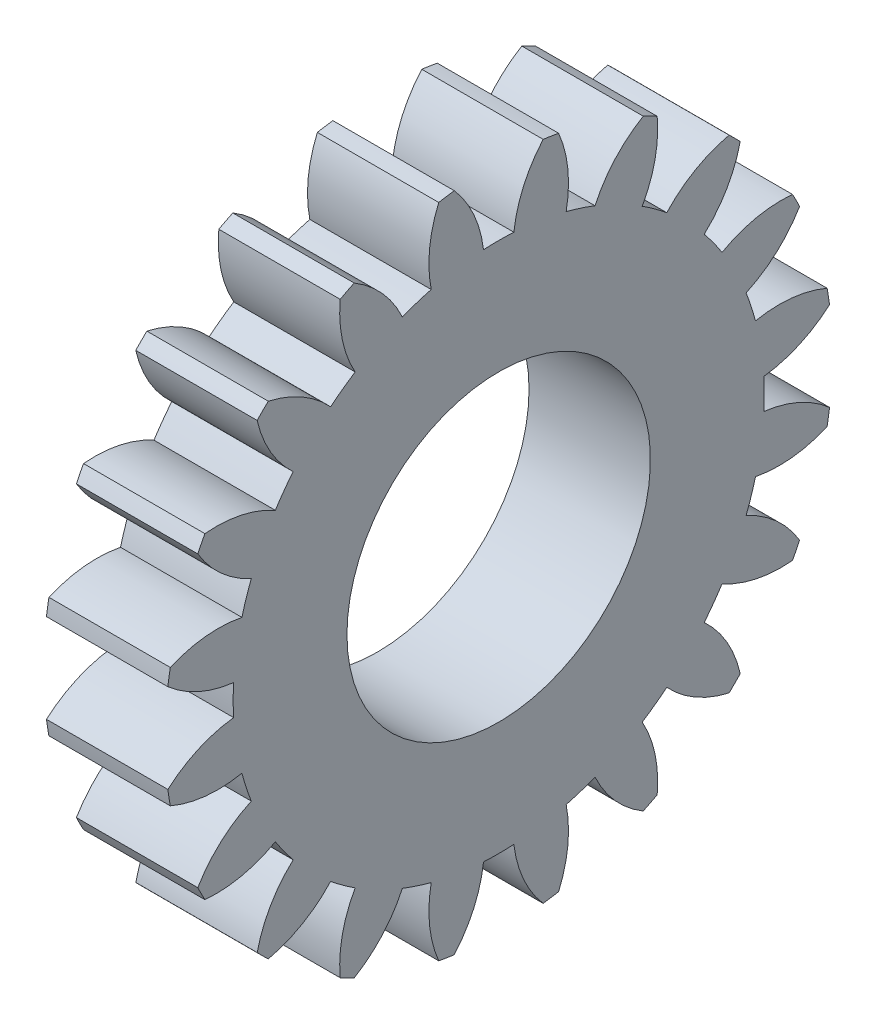
from build123d import *

# Parameters (mm, degrees)
BASPROSKE_W     = 4
BASPROSKE_H     = 11
TOOTHCUT_DEPTH  = 17.062378404
TEETHCUTS_COUNT = 20
TEETHCUTS_ANGLE = 342
BORSKE_R        = 5
BORE_DEPTH      = 50.0000508


with BuildPart() as part:
    # BasProSke → Base-Revolve (revolve)
    with BuildSketch(Plane(origin=(0, 0, 0), x_dir=(1, 0, 0), z_dir=(0, 1, 0)), mode=Mode.PRIVATE) as base_revolve_sk:
        with Locations((2, 5.5)):
            Rectangle(BASPROSKE_W, BASPROSKE_H)
    revolve(base_revolve_sk.sketch.rotate(Axis((-10, 0, 0), (1, 0, 0)), 180), axis=Axis((-10, 0, 0), (1, 0, 0)))

    # TooCutSke → ToothCut (cut, through all)
    with BuildSketch(Plane(origin=(0, 0, 0), x_dir=(0, 0, -1), z_dir=(1, 0, 0))):
        with BuildLine():
            ThreePointArc((0.499924007, 8.734705318), (0, 8.749), (-0.499924007, 8.734705318))
            ThreePointArc((-0.499924007, 8.734705318), (-0.824302243, 9.905497836), (-1.485192705, 10.924909509))
            ThreePointArc((-1.485192705, 10.924909509), (0, 11.0254), (1.485192705, 10.924909509))
            ThreePointArc((1.485192705, 10.924909509), (0.824302243, 9.905497836), (0.499924007, 8.734705318))
        make_face()
    toothcut = extrude(amount=TOOTHCUT_DEPTH, mode=Mode.SUBTRACT)

    # TeethCuts: ToothCut ×20 about axis
    teethcuts_axis = Axis((-10, 0, 0), (1, 0, 0))
    for i in range(1, TEETHCUTS_COUNT):
        add(toothcut.rotate(teethcuts_axis, i * TEETHCUTS_ANGLE / (TEETHCUTS_COUNT - 1)), mode=Mode.SUBTRACT)

    # BorSke → Bore (cut, symmetric)
    with BuildSketch(Plane(origin=(0, 0, 0), x_dir=(0, 0, -1), z_dir=(1, 0, 0))):
        with Locations(Location((0, 0, 0), (0, 0, 180))):
            Circle(BORSKE_R)
    extrude(amount=BORE_DEPTH, both=True, mode=Mode.SUBTRACT)


solid = part.part
